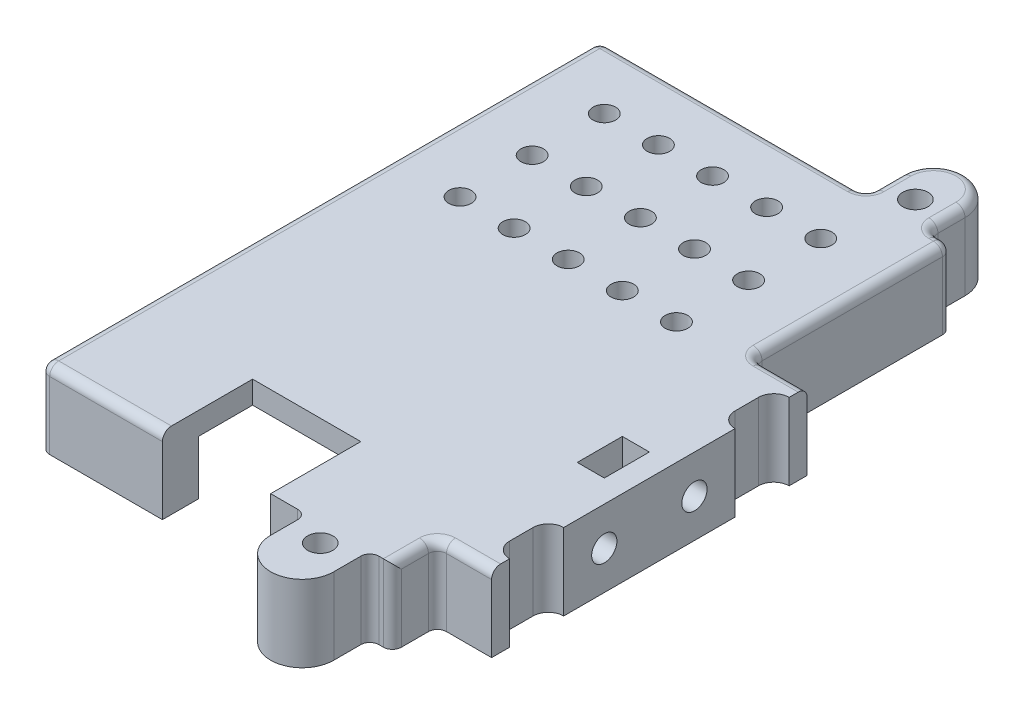
from build123d import *

# Parameters (mm, degrees)
SKETCH1_W                      = 39
SKETCH1_H                      = 62
SKETCH1_W_2                    = 31
SKETCH1_H_2                    = 54
BASE_DEPTH                     = 6
SKETCH2_W                      = 39
SKETCH2_H                      = 62
SKETCH2_R                      = 1.25
TOP_COVER_DEPTH                = 2.5
SKETCH3_R                      = 1.4
MOUNTING_ENDS_DEPTH            = 8.5
BASKET_MOUNTING_EDGE_DEPTH     = 8.5
SKETCH6_R                      = 1.4
BASKET_CLAMP_SCREW_HOLES_DEPTH = 8
SKETCH8_W                      = 12
SKETCH8_H                      = 8.5
USB_OPENING_DEPTH              = 10
F_1MM_EDGE_FILLETS_R           = 1
SKETCH7_W                      = 3
SKETCH7_H                      = 5
ZIP_TIE_HOLE_DEPTH             = 47.954765466


with BuildPart() as part:
    # Sketch1 → Base (new body)
    with BuildSketch(Plane(origin=(0, 0, 0), x_dir=(1, 0, 0), z_dir=(0, 1, 0))):
        Rectangle(SKETCH1_W, SKETCH1_H)
        Rectangle(SKETCH1_W_2, SKETCH1_H_2, mode=Mode.SUBTRACT)
    extrude(amount=BASE_DEPTH)

    # Sketch2 → Top Cover (add)
    with BuildSketch(Plane(origin=(0, 6, 0), x_dir=(1, 0, 0), z_dir=(0, 1, 0))):
        Rectangle(SKETCH2_W, SKETCH2_H)
        with Locations(Location((-12, 24, 0), (0, 0, 270))):
            Circle(SKETCH2_R, mode=Mode.SUBTRACT)
        with Locations(Location((-6, 24, 0), (0, 0, 270))):
            Circle(SKETCH2_R, mode=Mode.SUBTRACT)
        with Locations(Location((0, 24, 0), (0, 0, 270))):
            Circle(SKETCH2_R, mode=Mode.SUBTRACT)
        with Locations(Location((6, 24, 0), (0, 0, 270))):
            Circle(SKETCH2_R, mode=Mode.SUBTRACT)
        with Locations(Location((12, 24, 0), (0, 0, 270))):
            Circle(SKETCH2_R, mode=Mode.SUBTRACT)
        with Locations(Location((-6, 16, 0), (0, 0, 270))):
            Circle(SKETCH2_R, mode=Mode.SUBTRACT)
        with Locations(Location((0, 16, 0), (0, 0, 270))):
            Circle(SKETCH2_R, mode=Mode.SUBTRACT)
        with Locations(Location((6, 16, 0), (0, 0, 270))):
            Circle(SKETCH2_R, mode=Mode.SUBTRACT)
        with Locations(Location((12, 16, 0), (0, 0, 270))):
            Circle(SKETCH2_R, mode=Mode.SUBTRACT)
        with Locations(Location((-6, 8, 0), (0, 0, 270))):
            Circle(SKETCH2_R, mode=Mode.SUBTRACT)
        with Locations(Location((0, 8, 0), (0, 0, 270))):
            Circle(SKETCH2_R, mode=Mode.SUBTRACT)
        with Locations(Location((6, 8, 0), (0, 0, 270))):
            Circle(SKETCH2_R, mode=Mode.SUBTRACT)
        with Locations(Location((12, 8, 0), (0, 0, 270))):
            Circle(SKETCH2_R, mode=Mode.SUBTRACT)
        with Locations(Location((-12, 16, 0), (0, 0, 270))):
            Circle(SKETCH2_R, mode=Mode.SUBTRACT)
        with Locations(Location((-12, 8, 0), (0, 0, 270))):
            Circle(SKETCH2_R, mode=Mode.SUBTRACT)
    extrude(amount=TOP_COVER_DEPTH)

    # Sketch3 → Mounting Ends (add)
    # profile 1 of 2: a face of its own
    with BuildSketch(Plane(origin=(0, 0, 0), x_dir=(1, 0, 0), z_dir=(0, 1, 0))):
        with BuildLine():
            Line((10, 31), (17, 31))
            Line((17, 31), (17, 35))
            ThreePointArc((17, 35), (13.5, 38.5), (10, 35))
            Line((10, 35), (10, 31))
        make_face()
        with Locations(Location((13.5, 33, 0), (0, 0, 90))):
            Circle(SKETCH3_R, mode=Mode.SUBTRACT)
    # profile 2 of 2: a face of its own
    with BuildSketch(Plane(origin=(0, 0, 0), x_dir=(1, 0, 0), z_dir=(0, 1, 0))):
        with BuildLine():
            Line((10, -31), (10, -35))
            ThreePointArc((10, -35), (13.5, -38.5), (17, -35))
            Line((17, -35), (17, -31))
            Line((17, -31), (10, -31))
        make_face()
        with Locations(Location((13.5, -33, 0), (0, 0, 90))):
            Circle(SKETCH3_R, mode=Mode.SUBTRACT)
    extrude(amount=MOUNTING_ENDS_DEPTH)

    # Sketch5 → Basket Mounting Edge (add)
    with BuildSketch(Plane(origin=(0, 0, 0), x_dir=(1, 0, 0), z_dir=(0, 1, 0))):
        with BuildLine():
            Line((19.5, -26), (25.5, -26))
            Line((25.5, -26), (25.5, -24))
            ThreePointArc((25.5, -24), (24.297918472, -23.502081528), (23.8, -22.3))
            Line((23.8, -22.3), (23.8, -19.7))
            ThreePointArc((23.8, -19.7), (24.297918472, -18.497918472), (25.5, -18))
            Line((25.5, -18), (25.5, 1))
            ThreePointArc((25.5, 1), (24.297918472, 1.497918472), (23.8, 2.7))
            Line((23.8, 2.7), (23.8, 5.3))
            ThreePointArc((23.8, 5.3), (24.297918472, 6.502081528), (25.5, 7))
            Line((25.5, 7), (25.5, 9))
            Line((25.5, 9), (19.5, 9))
            Line((19.5, 9), (19.5, -26))
        make_face()
    extrude(amount=BASKET_MOUNTING_EDGE_DEPTH)

    # Sketch6 → Basket Clamp Screw Holes (cut)
    with BuildSketch(Plane(origin=(25.5, 0, 0), x_dir=(0, 0, -1), z_dir=(1, 0, 0))):
        with Locations((-13.5, 4.25)):
            Circle(SKETCH6_R)
        with Locations(Location((-3.5, 4.25, 0), (0, 0, 180))):
            Circle(SKETCH6_R)
    extrude(amount=-BASKET_CLAMP_SCREW_HOLES_DEPTH, mode=Mode.SUBTRACT)

    # Sketch8 → USB Opening (cut)
    with BuildSketch(Plane.XY.offset(31)):
        with Locations((0, 4.25)):
            Rectangle(SKETCH8_W, SKETCH8_H)
    extrude(amount=-USB_OPENING_DEPTH, mode=Mode.SUBTRACT)

    # 1mm Edge Fillets
    f_1mm_edge_fillets_edges = [part.edges().sort_by_distance(p)[0] for p in [
        (19.5, 8.5, -20),
        (19.5, 4.25, -9),
        (19.5, 4.25, 26),
        (22.5, 8.5, -9),
        (22.5, 8.5, 26),
        (-19.5, 8.5, 0),
        (-12.75, 8.5, 31),
        (19.5, 8.5, 28.5),
        (18.25, 8.5, -31),
        (-4.75, 8.5, -31),
        (17, 4.25, -31),
        (10, 4.25, -31),
        (13.5, 8.5, -38.5),
        (10, 8.5, -33),
        (17, 8.5, -33),
        (-19.5, 4.25, -31),
        (19.5, 4.25, -31),
        (19.5, 4.25, 31),
        (-19.5, 4.25, 31),
        (10, 4.25, 31),
        (17, 4.25, 31),
    ]]
    fillet(f_1mm_edge_fillets_edges, radius=F_1MM_EDGE_FILLETS_R)

    # Sketch7 → Zip Tie Hole (cut, through all)
    with BuildSketch(Plane(origin=(0, 8.5, 0), x_dir=(1, 0, 0), z_dir=(0, 1, 0))):
        with Locations((21.5, -8.5)):
            Rectangle(SKETCH7_W, SKETCH7_H)
    extrude(amount=-ZIP_TIE_HOLE_DEPTH, mode=Mode.SUBTRACT)


solid = part.part
